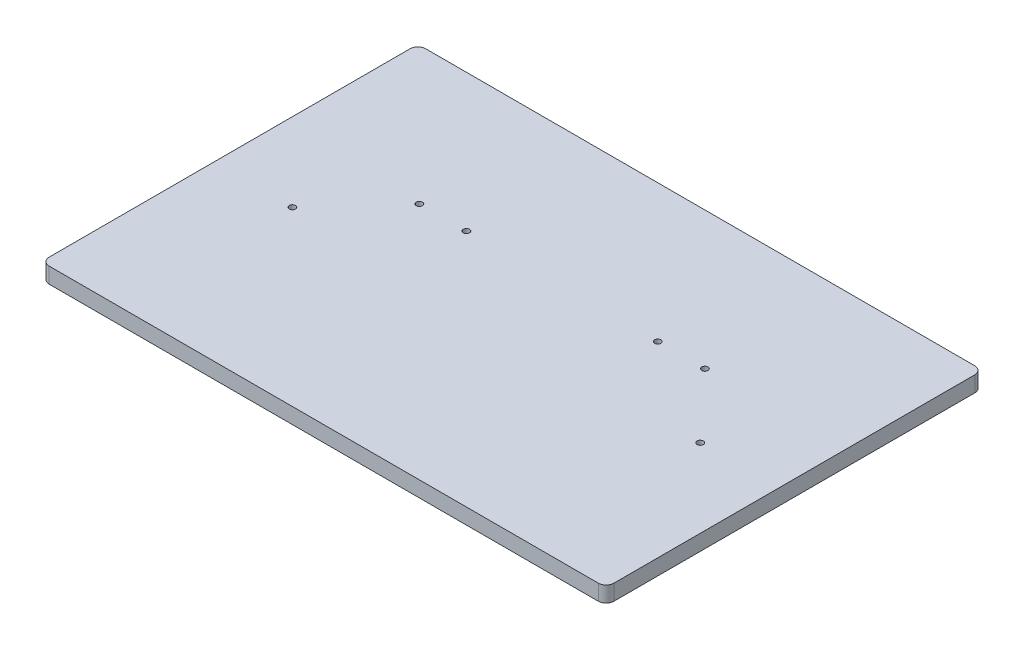
from build123d import *

# Parameters (mm, degrees)
SKETCH1_R           = 2.54
BOSS_EXTRUDE1_DEPTH = 12.7
SKETCH2_R           = 2.54
CUT_EXTRUDE1_DEPTH  = 12.7


with BuildPart() as part:
    # Sketch1 → Boss-Extrude1 (new body)
    with BuildSketch(Plane(origin=(0, 0, 0), x_dir=(1, 0, 0), z_dir=(0, 1, 0))):
        with BuildLine():
            Line((222.25, 152.4), (-222.25, 152.4))
            ThreePointArc((-222.25, 152.4), (-226.740128061, 150.540128061), (-228.6, 146.05))
            Line((-228.6, 146.05), (-228.6, -146.05))
            ThreePointArc((-228.6, -146.05), (-226.740128061, -150.540128061), (-222.25, -152.4))
            Line((-222.25, -152.4), (222.25, -152.4))
            ThreePointArc((222.25, -152.4), (226.740128061, -150.540128061), (228.6, -146.05))
            Line((228.6, -146.05), (228.6, 146.05))
            ThreePointArc((228.6, 146.05), (226.740128061, 150.540128061), (222.25, 152.4))
        make_face()
        with Locations(Location((-165.1, -12.7, 0), (0, 0, 270))):
            Circle(SKETCH1_R, mode=Mode.SUBTRACT)
        with Locations(Location((165.1, -12.7, 0), (0, 0, 90))):
            Circle(SKETCH1_R, mode=Mode.SUBTRACT)
    extrude(amount=BOSS_EXTRUDE1_DEPTH)

    # Sketch2 → Cut-Extrude1 (cut)
    with BuildSketch(Plane(origin=(0, 12.7, 0), x_dir=(1, 0, 0), z_dir=(0, 1, 0))):
        with Locations(Location((-116.06530762, 41.045936935, 0), (0, 0, 270))):
            Circle(SKETCH2_R)
        with Locations(Location((-77.96530762, 41.045936935, 0), (0, 0, 270))):
            Circle(SKETCH2_R)
        with Locations(Location((76.97469238, 41.045936935, 0), (0, 0, 270))):
            Circle(SKETCH2_R)
        with Locations(Location((115.07469238, 41.045936935, 0), (0, 0, 270))):
            Circle(SKETCH2_R)
    extrude(amount=-CUT_EXTRUDE1_DEPTH, mode=Mode.SUBTRACT)


solid = part.part
